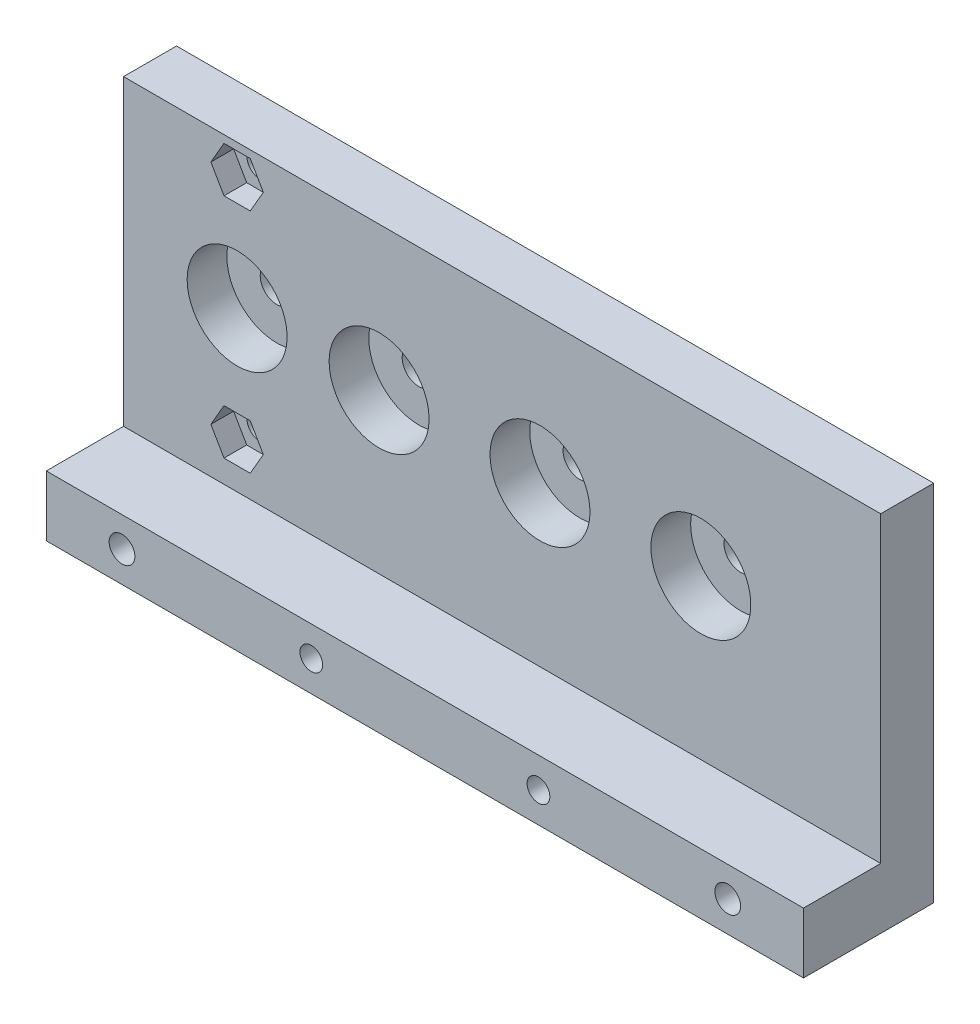
from build123d import *

# Parameters (mm, degrees)
SKETCH1_W           = 100
SKETCH1_H           = 48
BOSS_EXTRUDE1_DEPTH = 7
CUT_EXTRUDE1_REACH  = 113.144
SKETCH2_R           = 2.2
SKETCH3_W           = 100
SKETCH3_H           = 8
BOSS_EXTRUDE2_DEPTH = 10.2
SKETCH4_R           = 6.6
CUT_EXTRUDE2_DEPTH  = 5.25
SKETCH5_R           = 2.6
CUT_EXTRUDE3_DEPTH  = 7
SKETCH7_R           = 1.5
CUT_EXTRUDE4_DEPTH  = 112.391382072
CUT_EXTRUDE5_REACH  = 114.249
SKETCH8_R           = 1.7
CUT_EXTRUDE6_DEPTH  = 3
CUT_EXTRUDE7_REACH  = 114.249
SKETCH10_R          = 1.7
CUT_EXTRUDE8_DEPTH  = 3


with BuildPart() as part:
    # Sketch1 → Boss-Extrude1 (new body)
    with BuildSketch(Plane.XY):
        with Locations((50, 24)):
            Rectangle(SKETCH1_W, SKETCH1_H)
    extrude(amount=BOSS_EXTRUDE1_DEPTH)

    # Sketch2 → Cut-Extrude1 (cut, up to next)
    with BuildSketch(Plane.XY.offset(7), mode=Mode.PRIVATE) as cut_extrude1_sk1:
        with Locations((15, 29)):
            Circle(SKETCH2_R)
    cut_extrude1_tool1 = extrude(cut_extrude1_sk1.sketch, amount=-CUT_EXTRUDE1_REACH, mode=Mode.PRIVATE) & part.part
    # Sketch2 → Cut-Extrude1 (cut, up to next)
    with BuildSketch(Plane.XY.offset(7), mode=Mode.PRIVATE) as cut_extrude1_sk2:
        with Locations((33.75, 29)):
            Circle(SKETCH2_R)
    cut_extrude1_tool2 = extrude(cut_extrude1_sk2.sketch, amount=-CUT_EXTRUDE1_REACH, mode=Mode.PRIVATE) & part.part
    # Sketch2 → Cut-Extrude1 (cut, up to next)
    with BuildSketch(Plane.XY.offset(7), mode=Mode.PRIVATE) as cut_extrude1_sk3:
        with Locations((55, 29)):
            Circle(SKETCH2_R)
    cut_extrude1_tool3 = extrude(cut_extrude1_sk3.sketch, amount=-CUT_EXTRUDE1_REACH, mode=Mode.PRIVATE) & part.part
    # Sketch2 → Cut-Extrude1 (cut, up to next)
    with BuildSketch(Plane.XY.offset(7), mode=Mode.PRIVATE) as cut_extrude1_sk4:
        with Locations((76.25, 29)):
            Circle(SKETCH2_R)
    cut_extrude1_tool4 = extrude(cut_extrude1_sk4.sketch, amount=-CUT_EXTRUDE1_REACH, mode=Mode.PRIVATE) & part.part
    add(cut_extrude1_tool1.solids().sort_by_distance((15, 29, 7))[0], mode=Mode.SUBTRACT)
    add(cut_extrude1_tool2.solids().sort_by_distance((33.75, 29, 7))[0], mode=Mode.SUBTRACT)
    add(cut_extrude1_tool3.solids().sort_by_distance((55, 29, 7))[0], mode=Mode.SUBTRACT)
    add(cut_extrude1_tool4.solids().sort_by_distance((76.25, 29, 7))[0], mode=Mode.SUBTRACT)

    # Sketch3 → Boss-Extrude2 (add)
    with BuildSketch(Plane(origin=(0, 0, 0), x_dir=(-1, 0, 0), z_dir=(0, 0, -1))):
        with Locations((-50, 4)):
            Rectangle(SKETCH3_W, SKETCH3_H)
    extrude(amount=BOSS_EXTRUDE2_DEPTH)

    # Sketch4 → Cut-Extrude2 (cut)
    with BuildSketch(Plane(origin=(0, 0, 0), x_dir=(-1, 0, 0), z_dir=(0, 0, -1))):
        with Locations((-76.25, 29)):
            Circle(SKETCH4_R)
        with Locations((-55, 29)):
            Circle(SKETCH4_R)
        with Locations((-33.75, 29)):
            Circle(SKETCH4_R)
        with Locations((-15, 29)):
            Circle(SKETCH4_R)
    extrude(amount=-CUT_EXTRUDE2_DEPTH, mode=Mode.SUBTRACT)

    # Sketch5 → Cut-Extrude3 (cut)
    with BuildSketch(Plane.XY.offset(7)):
        with Locations((35.000022648, 4.052132501)):
            Circle(SKETCH5_R)
        with Locations((64.999977352, 4)):
            Circle(SKETCH5_R)
    extrude(amount=-CUT_EXTRUDE3_DEPTH, mode=Mode.SUBTRACT)

    # Sketch7 → Cut-Extrude4 (cut, through all)
    with BuildSketch(Plane.XY):
        with Locations((35.000022648, 4.052132501)):
            Circle(SKETCH7_R)
        with Locations((64.999977352, 4)):
            Circle(SKETCH7_R)
    extrude(amount=-CUT_EXTRUDE4_DEPTH, mode=Mode.SUBTRACT)

    # Sketch8 → Cut-Extrude5 (cut, up to next)
    with BuildSketch(Plane.XY.offset(7), mode=Mode.PRIVATE) as cut_extrude5_sk1:
        with Locations((10, 4.052132501)):
            Circle(SKETCH8_R)
    cut_extrude5_tool1 = extrude(cut_extrude5_sk1.sketch, amount=-CUT_EXTRUDE5_REACH, mode=Mode.PRIVATE) & part.part
    # Sketch8 → Cut-Extrude5 (cut, up to next)
    with BuildSketch(Plane.XY.offset(7), mode=Mode.PRIVATE) as cut_extrude5_sk2:
        with Locations((90, 4.052132501)):
            Circle(SKETCH8_R)
    cut_extrude5_tool2 = extrude(cut_extrude5_sk2.sketch, amount=-CUT_EXTRUDE5_REACH, mode=Mode.PRIVATE) & part.part
    add(cut_extrude5_tool1.solids().sort_by_distance((10, 4.052133, 7))[0], mode=Mode.SUBTRACT)
    add(cut_extrude5_tool2.solids().sort_by_distance((90, 4.052133, 7))[0], mode=Mode.SUBTRACT)


with BuildPart() as body_2:
    # Mirror1: mirrored copy
    add(part.part.mirror(Plane.XY.offset(-10.2)))

    # Sketch9 → Cut-Extrude6 (cut)
    with BuildSketch(Plane(origin=(0, 0, -27.4), x_dir=(-1, 0, 0), z_dir=(0, 0, -1))):
        Polygon((-88.267949192, 1.052132501), (-86.535898385, 4.052132501), (-88.267949192, 7.052132501), (-91.732050808, 7.052132501), (-93.464101615, 4.052132501), (-91.732050808, 1.052132501), align=None)
        Polygon((-13.464101615, 4.052132501), (-11.732050808, 1.052132501), (-8.267949192, 1.052132501), (-6.535898385, 4.052132501), (-8.267949192, 7.052132501), (-11.732050808, 7.052132501), align=None)
    extrude(amount=-CUT_EXTRUDE6_DEPTH, mode=Mode.SUBTRACT)

    # Sketch10 → Cut-Extrude7 (cut, up to next)
    with BuildSketch(Plane(origin=(0, 0, -27.4), x_dir=(-1, 0, 0), z_dir=(0, 0, -1)), mode=Mode.PRIVATE) as cut_extrude7_sk1:
        with Locations((-15, 44)):
            Circle(SKETCH10_R)
    cut_extrude7_tool1 = extrude(cut_extrude7_sk1.sketch, amount=-CUT_EXTRUDE7_REACH, mode=Mode.PRIVATE) & body_2.part
    # Sketch10 → Cut-Extrude7 (cut, up to next)
    with BuildSketch(Plane(origin=(0, 0, -27.4), x_dir=(-1, 0, 0), z_dir=(0, 0, -1)), mode=Mode.PRIVATE) as cut_extrude7_sk2:
        with Locations((-15, 14)):
            Circle(SKETCH10_R)
    cut_extrude7_tool2 = extrude(cut_extrude7_sk2.sketch, amount=-CUT_EXTRUDE7_REACH, mode=Mode.PRIVATE) & body_2.part
    add(cut_extrude7_tool1.solids().sort_by_distance((15, 44, -27.4))[0], mode=Mode.SUBTRACT)
    add(cut_extrude7_tool2.solids().sort_by_distance((15, 14, -27.4))[0], mode=Mode.SUBTRACT)

    # Sketch11 → Cut-Extrude8 (cut)
    with BuildSketch(Plane.XY.offset(-20.4)):
        Polygon((18.464101615, 44), (16.732050808, 47), (13.267949192, 47), (11.535898385, 44), (13.267949192, 41), (16.732050808, 41), align=None)
        Polygon((18.464101615, 14), (16.732050808, 17), (13.267949192, 17), (11.535898385, 14), (13.267949192, 11), (16.732050808, 11), align=None)
    extrude(amount=-CUT_EXTRUDE8_DEPTH, mode=Mode.SUBTRACT)


solid = body_2.part
